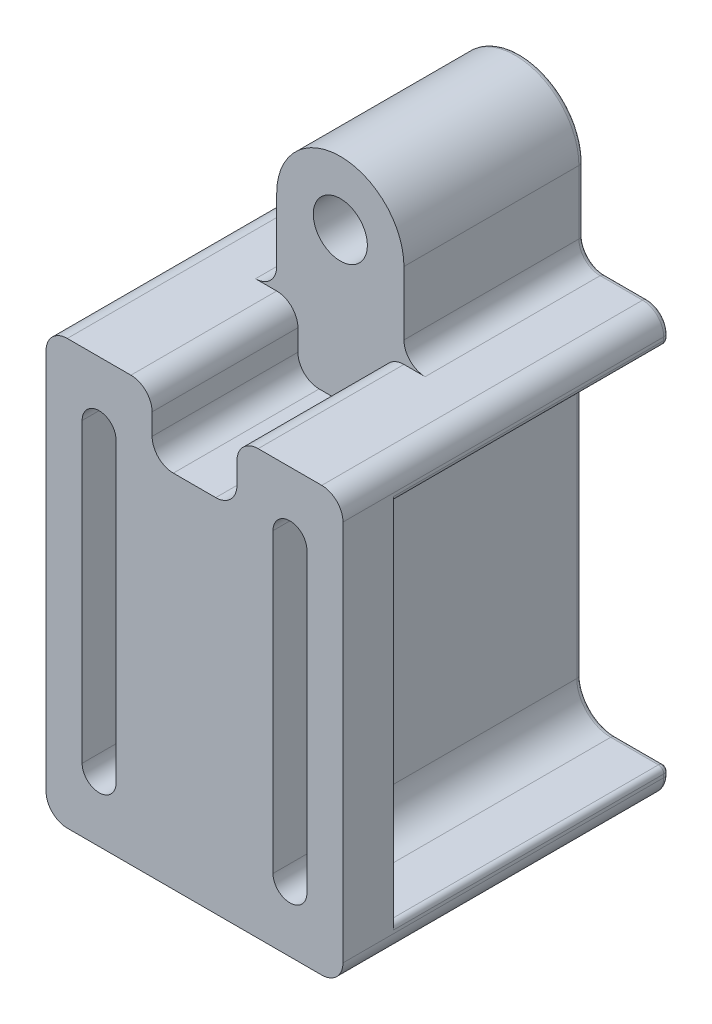
from build123d import *

# Parameters (mm, degrees)
SKETCH1_R               = 6
SKETCH1_R_2             = 1.9
BOSS_EXTRUDE1_DEPTH     = 6
SKETCH2_R               = 6
SKETCH2_R_2             = 2.55
BOSS_EXTRUDE2_DEPTH     = 11
SKETCH3_R               = 2.55
BOSS_EXTRUDE3_DEPTH     = 17
BOSS_EXTRUDE4_DEPTH     = 30.75
BOSS_EXTRUDE6_DEPTH     = 13.75
CUT_EXTRUDE1_DEPTH      = 26
CUT_EXTRUDE2_DEPTH      = 59.698913959
FILLET1_R               = 2
FILLET2_R               = 2
CUT_EXTRUDE3_DEPTH      = 3
CUT_EXTRUDE4_DEPTH      = 59.698913959
CUT_EXTRUDE4_DEPTH_BACK = 26
SKETCH12_W              = 5
SKETCH12_H              = 34.4
FILLET3_R               = 0.5


with BuildPart() as part:
    # Sketch1 → Boss-Extrude1 (new body)
    with BuildSketch(Plane.XY):
        Circle(SKETCH1_R)
        Circle(SKETCH1_R_2, mode=Mode.SUBTRACT)
    extrude(amount=BOSS_EXTRUDE1_DEPTH)

    # Sketch2 → Boss-Extrude2 (add)
    with BuildSketch(Plane.XY.offset(6)):
        Circle(SKETCH2_R)
        Circle(SKETCH2_R_2, mode=Mode.SUBTRACT)
    extrude(amount=BOSS_EXTRUDE2_DEPTH)

    # Sketch3 → Boss-Extrude3 (add)
    with BuildSketch(Plane(origin=(0, 0, 0), x_dir=(-1, 0, 0), z_dir=(0, 0, -1))):
        with BuildLine():
            Line((-6, 0), (-6, -16))
            Line((-6, -16), (6, -16))
            Line((6, -16), (6, 0))
            ThreePointArc((6, 0), (0, 6), (-6, 0))
        make_face()
        with Locations(Location((0, 0, 0), (0, 0, 180))):
            Circle(SKETCH3_R, mode=Mode.SUBTRACT)
    extrude(amount=-BOSS_EXTRUDE3_DEPTH)

    # Sketch4 → Boss-Extrude4 (add)
    with BuildSketch(Plane(origin=(0, 0, 0), x_dir=(-1, 0, 0), z_dir=(0, 0, -1))):
        Polygon((-6, -16), (-6, -8), (-14, -8), (-14, -48), (14, -48), (14, -8), (6, -8), (6, -16), align=None)
    extrude(amount=-BOSS_EXTRUDE4_DEPTH)

    # Sketch9 → Boss-Extrude6 (add)
    with BuildSketch(Plane.XY.offset(17)):
        Polygon((-6, -8), (-4, -8), (-4, -14), (4, -14), (4, -8), (6, -8), (6, -16), (-6, -16), align=None)
    extrude(amount=BOSS_EXTRUDE6_DEPTH)

    # Sketch5 → Cut-Extrude1 (cut)
    with BuildSketch(Plane(origin=(0, 0, 0), x_dir=(-1, 0, 0), z_dir=(0, 0, -1))):
        with BuildLine():
            Line((-5.8, -14), (-5.8, -42))
            ThreePointArc((-5.8, -42), (-9, -45.2), (-12.2, -42))
            Line((-12.2, -42), (-12.2, -14))
            ThreePointArc((-12.2, -14), (-9, -10.8), (-5.8, -14))
        make_face()
        with BuildLine():
            Line((5.8, -14), (5.8, -42))
            ThreePointArc((5.8, -42), (9, -45.2), (12.2, -42))
            Line((12.2, -42), (12.2, -14))
            ThreePointArc((12.2, -14), (9, -10.8), (5.8, -14))
        make_face()
    extrude(amount=-CUT_EXTRUDE1_DEPTH, mode=Mode.SUBTRACT)

    # Sketch7 → Cut-Extrude2 (cut, through all)
    with BuildSketch(Plane(origin=(0, 0, 0), x_dir=(-1, 0, 0), z_dir=(0, 0, -1))):
        with BuildLine():
            Line((-7.4, -14), (-7.4, -42))
            ThreePointArc((-7.4, -42), (-9, -43.6), (-10.6, -42))
            Line((-10.6, -42), (-10.6, -14))
            ThreePointArc((-10.6, -14), (-9, -12.4), (-7.4, -14))
        make_face()
        with BuildLine():
            Line((7.4, -14), (7.4, -42))
            ThreePointArc((7.4, -42), (9, -43.6), (10.6, -42))
            Line((10.6, -42), (10.6, -14))
            ThreePointArc((10.6, -14), (9, -12.4), (7.4, -14))
        make_face()
    extrude(amount=-CUT_EXTRUDE2_DEPTH, mode=Mode.SUBTRACT)

    # Fillet1
    fillet1_edges = [part.edges().sort_by_distance(p)[0] for p in [
        (6, -8, 8.5),
        (-6, -8, 8.5),
        (-14, -8, 15.375),
        (-14, -48, 15.375),
        (14, -48, 15.375),
        (14, -8, 15.375),
    ]]
    fillet(fillet1_edges, radius=FILLET1_R)

    # Fillet2
    fillet2_edges = [part.edges().sort_by_distance(p)[0] for p in [
        (-4, -8, 23.875),
        (-4, -14, 23.875),
        (4, -14, 23.875),
        (4, -8, 23.875),
    ]]
    fillet(fillet2_edges, radius=FILLET2_R)

    # Sketch10 → Cut-Extrude3 (cut)
    with BuildSketch(Plane(origin=(0, 0, 0), x_dir=(-1, 0, 0), z_dir=(0, 0, -1))):
        Polygon((0, 3.348631561), (-2.9, 1.674315781), (-2.9, -1.674315781), (0, -3.348631561), (2.9, -1.674315781), (2.9, 1.674315781), align=None)
    extrude(amount=-CUT_EXTRUDE3_DEPTH, mode=Mode.SUBTRACT)

    # Sketch12 → Cut-Extrude4 (cut, two sides: drawn at the far end of the back side and taken through both)
    with BuildSketch(Plane(origin=(0, 0, 0), x_dir=(-1, 0, 0), z_dir=(0, 0, -1)).offset(-CUT_EXTRUDE4_DEPTH_BACK)):
        with Locations((-11.5, -28)):
            Rectangle(SKETCH12_W, SKETCH12_H)
        with Locations((11.5, -28)):
            Rectangle(SKETCH12_W, SKETCH12_H)
    extrude(amount=CUT_EXTRUDE4_DEPTH + CUT_EXTRUDE4_DEPTH_BACK, mode=Mode.SUBTRACT)

    # Fillet3
    fillet3_edges = [part.edges().sort_by_distance(p)[0] for p in [
        (10, -8, 0),
        (-10, -8, 0),
        (-6, -3, 0),
        (0, -48, 0),
        (14, -10.4, 0),
        (-14, -45.6, 0),
        (13.414213562, -8.585786438, 0),
        (13.414213562, -47.414213562, 0),
        (-13.414213562, -8.585786438, 0),
        (-13.414213562, -47.414213562, 0),
        (6.585786438, -7.414213562, 0),
        (-6.585786438, -7.414213562, 0),
        (0, 6, 0),
        (6, -3, 0),
        (-1.45, 2.511473671, 0),
        (1.45, 2.511473671, 0),
        (2.9, 0, 0),
        (1.45, -2.511473671, 0),
        (-1.45, -2.511473671, 0),
        (-2.9, 0, 0),
        (6.7372583, -44.2627417, 0),
        (-6.7372583, -11.7372583, 0),
        (14, -45.6, 0),
        (-14, -10.4, 0),
        (14, -45.2, 13),
        (11.5, -45.2, 0),
        (14, -10.8, 13),
        (11.5, -10.8, 0),
        (-14, -10.8, 13),
        (-11.5, -10.8, 0),
        (-14, -45.2, 13),
        (-11.5, -45.2, 0),
        (6.7372583, -11.7372583, 0),
        (5.8, -28, 0),
        (-5.8, -28, 0),
        (-6.7372583, -44.2627417, 0),
    ]]
    fillet(fillet3_edges, radius=FILLET3_R)


solid = part.part
